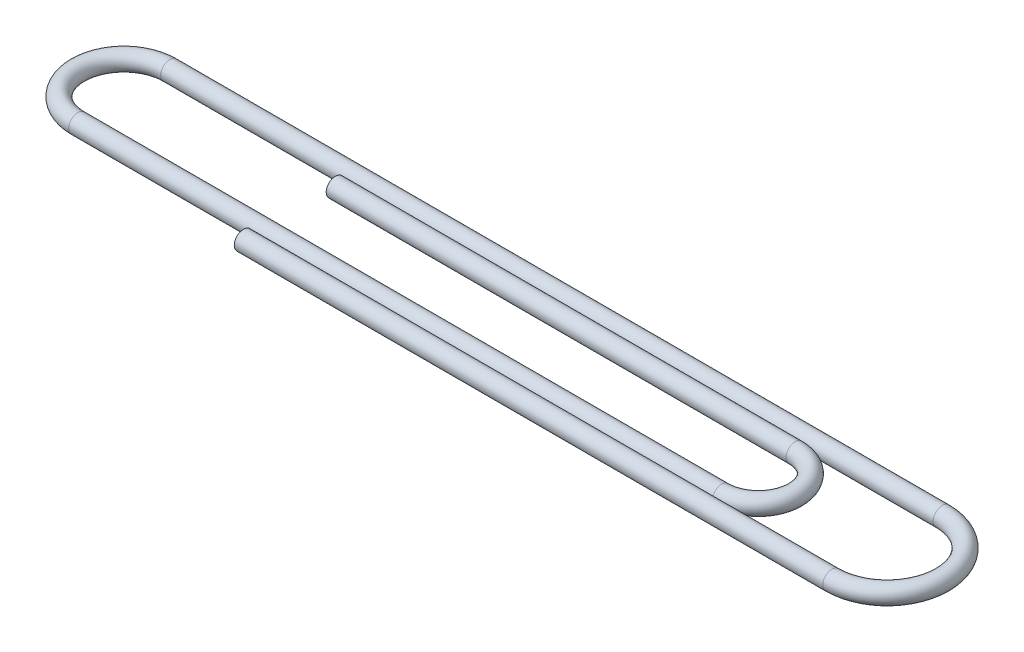
from build123d import *

# Parameters (mm, degrees)
SWEEP1_PROFILE_R = 0.49995


with BuildPart() as part:
    # Sweep1: sweep along a path in Sketch2
    with BuildLine(Plane(origin=(0, 0, 0), x_dir=(1, 0, 0), z_dir=(0, 1, 0))) as sweep1_path:
        Line((0, 0), (32, 0))
        ThreePointArc((32, 0), (35, 3), (32, 6))
        Line((32, 6), (-10, 6))
        ThreePointArc((-10, 6), (-12.5, 3.5), (-10, 1))
        Line((-10, 1), (25, 1))
        ThreePointArc((25, 1), (27, 3), (25, 5))
        Line((25, 5), (0, 5))
    # Sweep1 profile (on start of the path) → Sweep1 (sweep)
    with BuildSketch(Plane(origin=(0, 0, 0), x_dir=(0, 0, 1), z_dir=(1, 0, 0))):
        Circle(SWEEP1_PROFILE_R)
    sweep(path=sweep1_path.line)


solid = part.part
